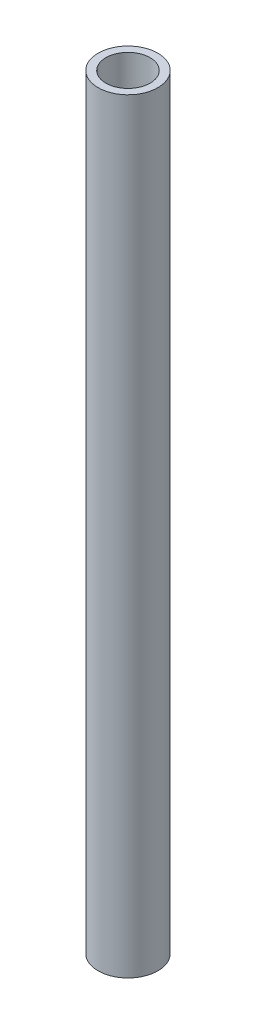
from build123d import *

# Parameters (mm, degrees)
SKETCH1_R           = 10.668
SKETCH1_R_2         = 7.8994
BOSS_EXTRUDE1_DEPTH = 273.05


with BuildPart() as part:
    # Sketch1 → Boss-Extrude1 (new body)
    with BuildSketch(Plane(origin=(0, 0, 0), x_dir=(1, 0, 0), z_dir=(0, 1, 0))):
        with Locations(Location((0, 0, 0), (0, 0, 270))):
            Circle(SKETCH1_R)
        with Locations(Location((0, 0, 0), (0, 0, 270))):
            Circle(SKETCH1_R_2, mode=Mode.SUBTRACT)
    extrude(amount=BOSS_EXTRUDE1_DEPTH)


solid = part.part
